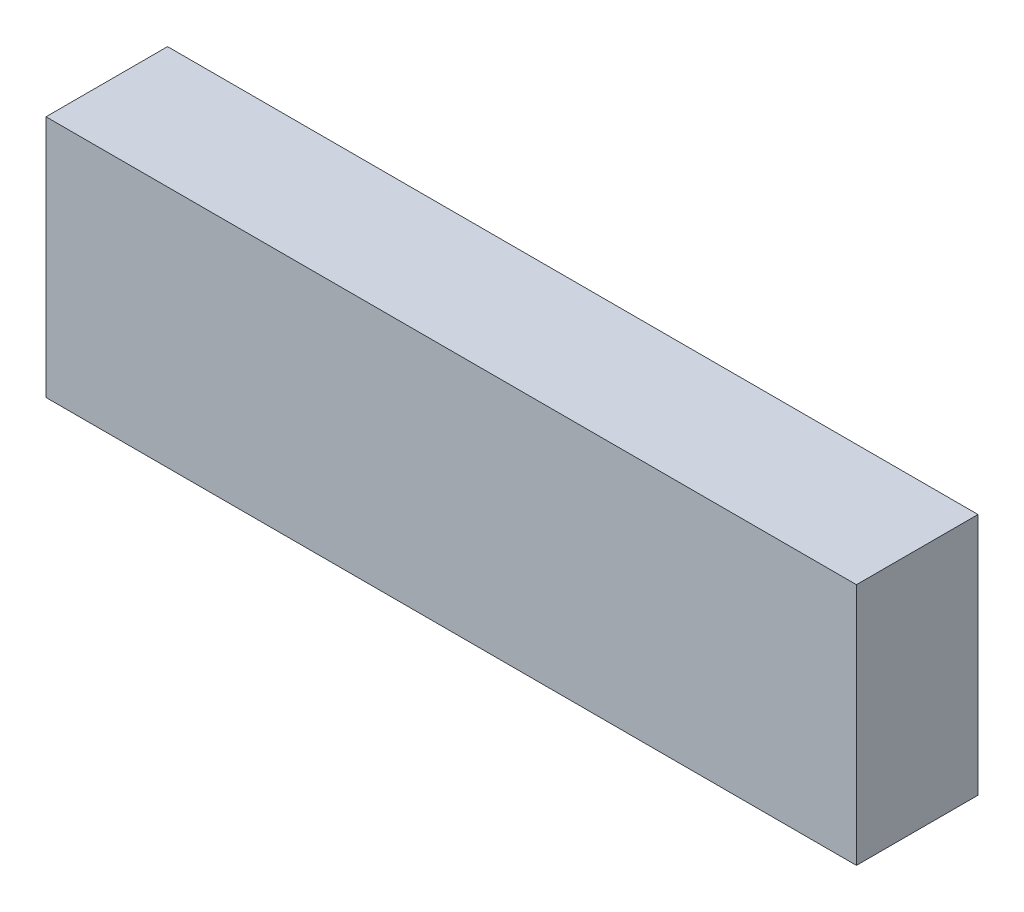
from build123d import *

# Parameters (mm, degrees)
SKETCH1_W           = 6
SKETCH1_H           = 12
BOSS_EXTRUDE1_DEPTH = 40


with BuildPart() as part:
    # Sketch1 → Boss-Extrude1 (new body)
    with BuildSketch(Plane(origin=(0, 0, 0), x_dir=(0, 0, -1), z_dir=(1, 0, 0))):
        with Locations((3, 6)):
            Rectangle(SKETCH1_W, SKETCH1_H)
    extrude(amount=BOSS_EXTRUDE1_DEPTH)


solid = part.part
